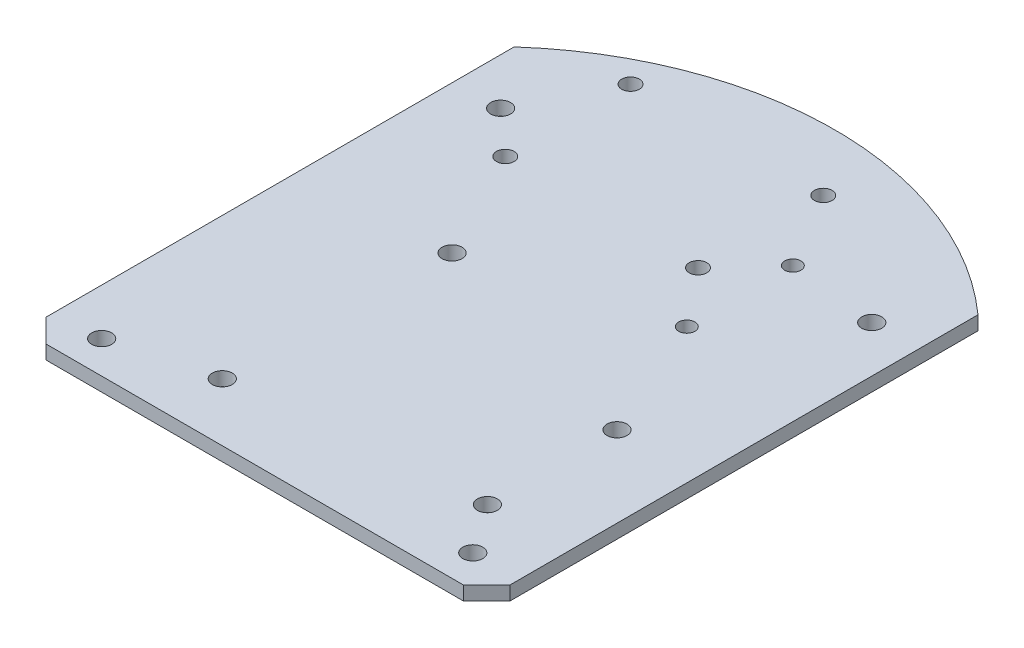
from build123d import *

# Parameters (mm, degrees)
SKETCH1_W               = 100
SKETCH1_H               = 100
BOSS_EXTRUDE1_DEPTH     = 3
SKETCH2_R               = 1.75
CUT_EXTRUDE1_DEPTH      = 71.774289117
MIRROR2_COPY_1_SKETCH_R = 1.75
MIRROR2_COPY_1_DEPTH    = 71.774289117
CHAMFER1_SIZE           = 5
SKETCH9_R               = 1.75
BOSS_EXTRUDE2_DEPTH     = 3
CUT_EXTRUDE4_REACH      = 92.189
SKETCH6_R               = 1.75
SKETCH10_R              = 2.15
SKETCH10_R_2            = 1.75
SKETCH10_R_3            = 1.9
SKETCH10_R_4            = 1.5
CUT_EXTRUDE5_DEPTH      = 3
SKETCH13_R              = 1.75
CUT_EXTRUDE6_DEPTH      = 3


with BuildPart() as part:
    # Sketch1 → Boss-Extrude1 (new body)
    with BuildSketch(Plane(origin=(0, 0, 0), x_dir=(1, 0, 0), z_dir=(0, 1, 0))):
        Rectangle(SKETCH1_W, SKETCH1_H)
    extrude(amount=BOSS_EXTRUDE1_DEPTH)

    # Sketch2 → Cut-Extrude1 (cut, through all)
    with BuildSketch(Plane(origin=(0, 3, 0), x_dir=(1, 0, 0), z_dir=(0, 1, 0))):
        with Locations(Location((-40, 43, 0), (0, 0, 270))):
            Circle(SKETCH2_R)
    cut_extrude1 = extrude(amount=-CUT_EXTRUDE1_DEPTH, mode=Mode.SUBTRACT)

    # Mirror1: Cut-Extrude1 across plane
    add(cut_extrude1.mirror(Plane(origin=(0, 0, 0), x_dir=(0, 0, 1), z_dir=(1, 0, 0))), mode=Mode.SUBTRACT)

    # Mirror2: Cut-Extrude1 across plane
    add(cut_extrude1.mirror(Plane.XY), mode=Mode.SUBTRACT)

    # Mirror2 copy 1 sketch → Mirror2 copy 1 (cut, through all)
    with BuildSketch(Plane(origin=(0, 3, 0), x_dir=(-1, 0, 0), z_dir=(0, 1, 0))):
        with Locations(Location((-40, 43, 0), (0, 0, 270))):
            Circle(MIRROR2_COPY_1_SKETCH_R)
    extrude(amount=-MIRROR2_COPY_1_DEPTH, mode=Mode.SUBTRACT)

    # Chamfer1
    chamfer1_edges = [part.edges().sort_by_distance(p)[0] for p in [
        (-50, 1.5, -50),
        (50, 1.5, -50),
        (50, 1.5, 50),
        (-50, 1.5, 50),
    ]]
    chamfer(chamfer1_edges, length=CHAMFER1_SIZE)

    # Sketch9 → Boss-Extrude2 (add)
    with BuildSketch(Plane(origin=(0, 3, 0), x_dir=(1, 0, 0), z_dir=(0, 1, 0))):
        with BuildLine():
            Line((45, 50), (50, 45))
            Line((50, 45), (50, 55.901699437))
            ThreePointArc((50, 55.901699437), (0, 75), (-50, 55.901699437))
            Line((-50, 55.901699437), (-50, 45))
            Line((-50, 45), (-45, 50))
            Line((-45, 50), (45, 50))
        make_face()
        with Locations(Location((-30.5, 61.5, 0), (0, 0, 270))):
            Circle(SKETCH9_R, mode=Mode.SUBTRACT)
    extrude(amount=-BOSS_EXTRUDE2_DEPTH)

    # Sketch6 → Cut-Extrude4 (cut, up to next)
    with BuildSketch(Plane(origin=(0, 3, 0), x_dir=(1, 0, 0), z_dir=(0, 1, 0)), mode=Mode.PRIVATE) as cut_extrude4_sk1:
        with Locations(Location((-18.23, 10.76, 0), (0, 0, 270))):
            Circle(SKETCH6_R)
    cut_extrude4_tool1 = extrude(cut_extrude4_sk1.sketch, amount=-CUT_EXTRUDE4_REACH, mode=Mode.PRIVATE) & part.part
    # Sketch6 → Cut-Extrude4 (cut, up to next)
    with BuildSketch(Plane(origin=(0, 3, 0), x_dir=(1, 0, 0), z_dir=(0, 1, 0)), mode=Mode.PRIVATE) as cut_extrude4_sk2:
        with Locations(Location((-19.5, -37.5, 0), (0, 0, 270))):
            Circle(SKETCH6_R)
    cut_extrude4_tool2 = extrude(cut_extrude4_sk2.sketch, amount=-CUT_EXTRUDE4_REACH, mode=Mode.PRIVATE) & part.part
    # Sketch6 → Cut-Extrude4 (cut, up to next)
    with BuildSketch(Plane(origin=(0, 3, 0), x_dir=(1, 0, 0), z_dir=(0, 1, 0)), mode=Mode.PRIVATE) as cut_extrude4_sk3:
        with Locations(Location((32.57, -32.42, 0), (0, 0, 270))):
            Circle(SKETCH6_R)
    cut_extrude4_tool3 = extrude(cut_extrude4_sk3.sketch, amount=-CUT_EXTRUDE4_REACH, mode=Mode.PRIVATE) & part.part
    # Sketch6 → Cut-Extrude4 (cut, up to next)
    with BuildSketch(Plane(origin=(0, 3, 0), x_dir=(1, 0, 0), z_dir=(0, 1, 0)), mode=Mode.PRIVATE) as cut_extrude4_sk4:
        with Locations(Location((32.57, -4.48, 0), (0, 0, 270))):
            Circle(SKETCH6_R)
    cut_extrude4_tool4 = extrude(cut_extrude4_sk4.sketch, amount=-CUT_EXTRUDE4_REACH, mode=Mode.PRIVATE) & part.part
    add(cut_extrude4_tool1.solids().sort_by_distance((-18.23, 3, -10.76))[0], mode=Mode.SUBTRACT)
    add(cut_extrude4_tool2.solids().sort_by_distance((-19.5, 3, 37.5))[0], mode=Mode.SUBTRACT)
    add(cut_extrude4_tool3.solids().sort_by_distance((32.57, 3, 32.42))[0], mode=Mode.SUBTRACT)
    add(cut_extrude4_tool4.solids().sort_by_distance((32.57, 3, 4.48))[0], mode=Mode.SUBTRACT)

    # Sketch10 → Cut-Extrude5 (cut)
    # profile 1 of 26: a face of its own
    with BuildSketch(Plane(origin=(0, 3, 0), x_dir=(1, 0, 0), z_dir=(0, 1, 0))):
        with Locations(Location((-40, 43, 0), (0, 0, 270))):
            Circle(SKETCH10_R)
        with Locations((-40, 43)):
            Circle(SKETCH10_R_2, mode=Mode.SUBTRACT)
    # profile 2 of 26: a face of its own
    with BuildSketch(Plane(origin=(0, 3, 0), x_dir=(1, 0, 0), z_dir=(0, 1, 0))):
        with Locations((-40, 43)):
            Circle(SKETCH10_R_2)
    # profile 3 of 26: a face of its own
    with BuildSketch(Plane(origin=(0, 3, 0), x_dir=(1, 0, 0), z_dir=(0, 1, 0))):
        with Locations(Location((-30.5, 61.5, 0), (0, 0, 270))):
            Circle(SKETCH10_R_3)
        with Locations((-30.5, 61.5)):
            Circle(SKETCH10_R_2, mode=Mode.SUBTRACT)
    # profile 4 of 26: a face of its own
    with BuildSketch(Plane(origin=(0, 3, 0), x_dir=(1, 0, 0), z_dir=(0, 1, 0))):
        with Locations((-30.5, 61.5)):
            Circle(SKETCH10_R_2)
        with Locations((-30.5, 61.5)):
            Circle(SKETCH10_R_4, mode=Mode.SUBTRACT)
    # profile 5 of 26: a face of its own
    with BuildSketch(Plane(origin=(0, 3, 0), x_dir=(1, 0, 0), z_dir=(0, 1, 0))):
        with Locations((-30.5, 61.5)):
            Circle(SKETCH10_R_4)
    # profile 6 of 26: a face of its own
    with BuildSketch(Plane(origin=(0, 3, 0), x_dir=(1, 0, 0), z_dir=(0, 1, 0))):
        with Locations(Location((-30.5, 34.5, 0), (0, 0, 270))):
            Circle(SKETCH10_R_3)
        with Locations((-30.5, 34.5)):
            Circle(SKETCH10_R_4, mode=Mode.SUBTRACT)
    # profile 7 of 26: a face of its own
    with BuildSketch(Plane(origin=(0, 3, 0), x_dir=(1, 0, 0), z_dir=(0, 1, 0))):
        with Locations((-30.5, 34.5)):
            Circle(SKETCH10_R_4)
    # profile 8 of 26: a face of its own
    with BuildSketch(Plane(origin=(0, 3, 0), x_dir=(1, 0, 0), z_dir=(0, 1, 0))):
        with Locations(Location((-18.23, 10.76, 0), (0, 0, 270))):
            Circle(SKETCH10_R)
        with Locations((-18.23, 10.76)):
            Circle(SKETCH10_R_2, mode=Mode.SUBTRACT)
    # profile 9 of 26: a face of its own
    with BuildSketch(Plane(origin=(0, 3, 0), x_dir=(1, 0, 0), z_dir=(0, 1, 0))):
        with Locations((-18.23, 10.76)):
            Circle(SKETCH10_R_2)
    # profile 10 of 26: a face of its own
    with BuildSketch(Plane(origin=(0, 3, 0), x_dir=(1, 0, 0), z_dir=(0, 1, 0))):
        with Locations(Location((-19.5, -37.5, 0), (0, 0, 270))):
            Circle(SKETCH10_R)
        with Locations((-19.5, -37.5)):
            Circle(SKETCH10_R_2, mode=Mode.SUBTRACT)
    # profile 11 of 26: a face of its own
    with BuildSketch(Plane(origin=(0, 3, 0), x_dir=(1, 0, 0), z_dir=(0, 1, 0))):
        with Locations((-19.5, -37.5)):
            Circle(SKETCH10_R_2)
    # profile 12 of 26: a face of its own
    with BuildSketch(Plane(origin=(0, 3, 0), x_dir=(1, 0, 0), z_dir=(0, 1, 0))):
        with Locations(Location((-40, -43, 0), (0, 0, 270))):
            Circle(SKETCH10_R)
        with Locations((-40, -43)):
            Circle(SKETCH10_R_2, mode=Mode.SUBTRACT)
    # profile 13 of 26: a face of its own
    with BuildSketch(Plane(origin=(0, 3, 0), x_dir=(1, 0, 0), z_dir=(0, 1, 0))):
        with Locations((-40, -43)):
            Circle(SKETCH10_R_2)
    # profile 14 of 26: a face of its own
    with BuildSketch(Plane(origin=(0, 3, 0), x_dir=(1, 0, 0), z_dir=(0, 1, 0))):
        with Locations(Location((40, -43, 0), (0, 0, 270))):
            Circle(SKETCH10_R)
        with Locations((40, -43)):
            Circle(SKETCH10_R_2, mode=Mode.SUBTRACT)
    # profile 15 of 26: a face of its own
    with BuildSketch(Plane(origin=(0, 3, 0), x_dir=(1, 0, 0), z_dir=(0, 1, 0))):
        with Locations((40, -43)):
            Circle(SKETCH10_R_2)
    # profile 16 of 26: a face of its own
    with BuildSketch(Plane(origin=(0, 3, 0), x_dir=(1, 0, 0), z_dir=(0, 1, 0))):
        with Locations(Location((32.57, -32.42, 0), (0, 0, 270))):
            Circle(SKETCH10_R)
        with Locations((32.57, -32.42)):
            Circle(SKETCH10_R_2, mode=Mode.SUBTRACT)
    # profile 17 of 26: a face of its own
    with BuildSketch(Plane(origin=(0, 3, 0), x_dir=(1, 0, 0), z_dir=(0, 1, 0))):
        with Locations((32.57, -32.42)):
            Circle(SKETCH10_R_2)
    # profile 18 of 26: a face of its own
    with BuildSketch(Plane(origin=(0, 3, 0), x_dir=(1, 0, 0), z_dir=(0, 1, 0))):
        with Locations(Location((32.57, -4.48, 0), (0, 0, 270))):
            Circle(SKETCH10_R)
        with Locations((32.57, -4.48)):
            Circle(SKETCH10_R_2, mode=Mode.SUBTRACT)
    # profile 19 of 26: a face of its own
    with BuildSketch(Plane(origin=(0, 3, 0), x_dir=(1, 0, 0), z_dir=(0, 1, 0))):
        with Locations((32.57, -4.48)):
            Circle(SKETCH10_R_2)
    # profile 20 of 26: a face of its own
    with BuildSketch(Plane(origin=(0, 3, 0), x_dir=(1, 0, 0), z_dir=(0, 1, 0))):
        with Locations(Location((40, 43, 0), (0, 0, 270))):
            Circle(SKETCH10_R)
        with Locations((40, 43)):
            Circle(SKETCH10_R_2, mode=Mode.SUBTRACT)
    # profile 21 of 26: a face of its own
    with BuildSketch(Plane(origin=(0, 3, 0), x_dir=(1, 0, 0), z_dir=(0, 1, 0))):
        with Locations((40, 43)):
            Circle(SKETCH10_R_2)
    # profile 22 of 26: a face of its own
    with BuildSketch(Plane(origin=(0, 3, 0), x_dir=(1, 0, 0), z_dir=(0, 1, 0))):
        with Locations(Location((11.05, 34.5, 0), (0, 0, 270))):
            Circle(SKETCH10_R_3)
        with Locations((11.05, 34.5)):
            Circle(SKETCH10_R_4, mode=Mode.SUBTRACT)
    # profile 23 of 26: a face of its own
    with BuildSketch(Plane(origin=(0, 3, 0), x_dir=(1, 0, 0), z_dir=(0, 1, 0))):
        with Locations((11.05, 34.5)):
            Circle(SKETCH10_R_4)
    # profile 24 of 26: a face of its own
    with BuildSketch(Plane(origin=(0, 3, 0), x_dir=(1, 0, 0), z_dir=(0, 1, 0))):
        with Locations(Location((11.05, 61.5, 0), (0, 0, 270))):
            Circle(SKETCH10_R_3)
        with Locations((11.05, 61.5)):
            Circle(SKETCH10_R_2, mode=Mode.SUBTRACT)
    # profile 25 of 26: a face of its own
    with BuildSketch(Plane(origin=(0, 3, 0), x_dir=(1, 0, 0), z_dir=(0, 1, 0))):
        with Locations((11.05, 61.5)):
            Circle(SKETCH10_R_2)
        with Locations((11.05, 61.5)):
            Circle(SKETCH10_R_4, mode=Mode.SUBTRACT)
    # profile 26 of 26: a face of its own
    with BuildSketch(Plane(origin=(0, 3, 0), x_dir=(1, 0, 0), z_dir=(0, 1, 0))):
        with Locations((11.05, 61.5)):
            Circle(SKETCH10_R_4)
    extrude(amount=-CUT_EXTRUDE5_DEPTH, mode=Mode.SUBTRACT)

    # Sketch13 → Cut-Extrude6 (cut)
    with BuildSketch(Plane(origin=(0, 3, 0), x_dir=(1, 0, 0), z_dir=(0, 1, 0))):
        with Locations(Location((20.855220052, 45.129061124, 0), (0, 0, 270))):
            Circle(SKETCH13_R)
        with Locations(Location((20.834109359, 22.297361761, 0), (0, 0, 270))):
            Circle(SKETCH13_R)
    extrude(amount=-CUT_EXTRUDE6_DEPTH, mode=Mode.SUBTRACT)


solid = part.part
